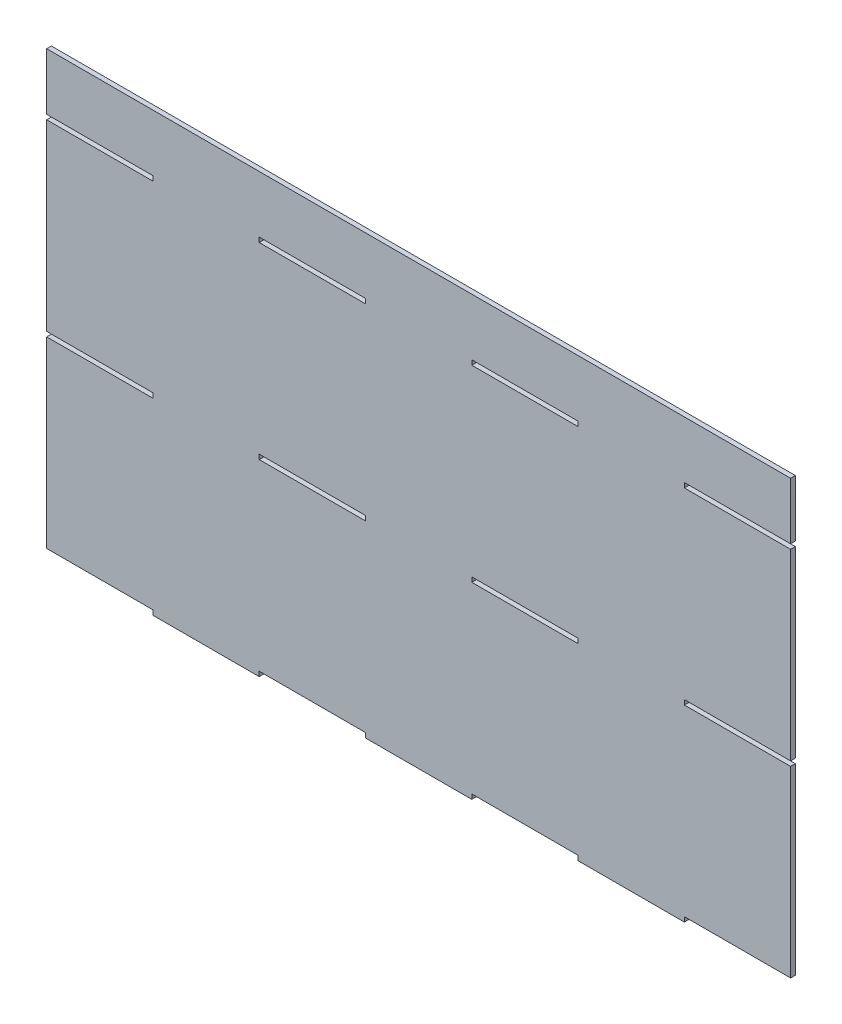
from build123d import *

# Parameters (mm, degrees)
SKETCH1_W           = 71.428571428
SKETCH1_H           = 3.175
SKETCH1_W_2         = 71.428571429
BOSS_EXTRUDE1_DEPTH = 3.175


with BuildPart() as part:
    # Sketch1 → Boss-Extrude1 (new body)
    with BuildSketch(Plane.XY):
        Polygon((50.899754495, -0.012509515), (122.328325923, -0.012509515), (122.328325923, 3.162490485), (193.756897352, 3.162490485), (193.756897352, -0.012509515), (265.185468781, -0.012509515), (265.185468781, 3.162490485), (336.614040209, 3.162490485), (336.614040209, -0.012509515), (408.042611638, -0.012509515), (408.042611638, 3.162490485), (479.471183066, 3.162490485), (479.471183066, 126.337490485), (408.042611638, 126.337490485), (408.042611638, 129.512490485), (479.471183066, 129.512490485), (479.471183066, 252.687490485), (408.042611638, 252.687490485), (408.042611638, 255.862490485), (479.471183066, 255.862490485), (479.471183066, 294.037490485), (166.471183066, 294.037490485), (-20.528816934, 294.037490485), (-20.528816934, 255.862490485), (50.899754495, 255.862490485), (50.899754495, 252.687490485), (-20.528816934, 252.687490485), (-20.528816934, 129.512490485), (50.899754495, 129.512490485), (50.899754495, 126.337490485), (-20.528816934, 126.337490485), (-20.528816934, 3.162490485), (50.899754495, 3.162490485), align=None)
        with Locations((300.899754495, 127.924990485)):
            Rectangle(SKETCH1_W, SKETCH1_H, mode=Mode.SUBTRACT)
        with Locations((300.899754495, 254.274990485)):
            Rectangle(SKETCH1_W, SKETCH1_H, mode=Mode.SUBTRACT)
        with Locations((158.042611638, 127.924990485)):
            Rectangle(SKETCH1_W_2, SKETCH1_H, mode=Mode.SUBTRACT)
        with Locations((158.042611638, 254.274990485)):
            Rectangle(SKETCH1_W_2, SKETCH1_H, mode=Mode.SUBTRACT)
    extrude(amount=BOSS_EXTRUDE1_DEPTH)


solid = part.part
